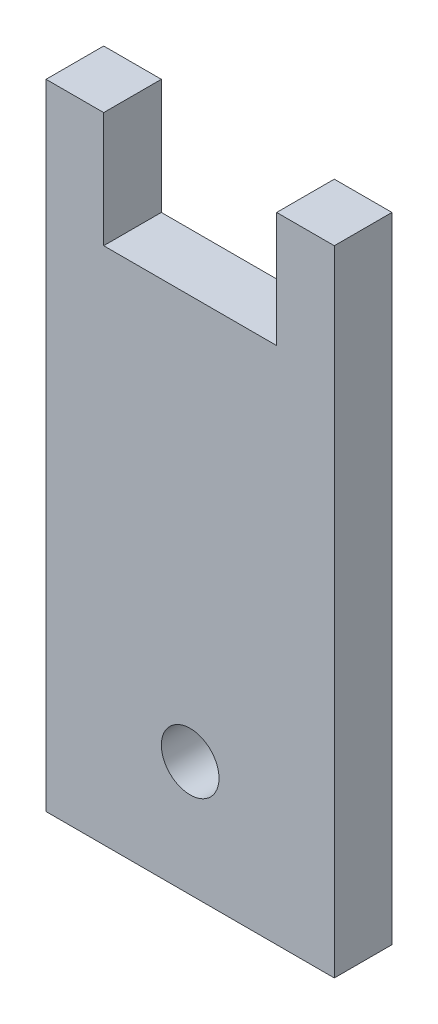
from build123d import *

# Parameters (mm, degrees)
BOSS_EXTRUDE1_DEPTH = 5
SKETCH2_R           = 2.5
CUT_EXTRUDE1_DEPTH  = 31.618621785


with BuildPart() as part:
    # Sketch1 → Boss-Extrude1 (new body)
    with BuildSketch(Plane.XY):
        Polygon((-7.5, 27.5), (-7.5, 17.5), (7.5, 17.5), (7.5, 27.5), (12.5, 27.5), (12.5, -27.5), (-12.5, -27.5), (-12.5, 27.5), align=None)
    extrude(amount=BOSS_EXTRUDE1_DEPTH)

    # Sketch2 → Cut-Extrude1 (cut, through all)
    with BuildSketch(Plane.XY.offset(5)):
        with Locations((0, -17.5)):
            Circle(SKETCH2_R)
    extrude(amount=-CUT_EXTRUDE1_DEPTH, mode=Mode.SUBTRACT)


solid = part.part
